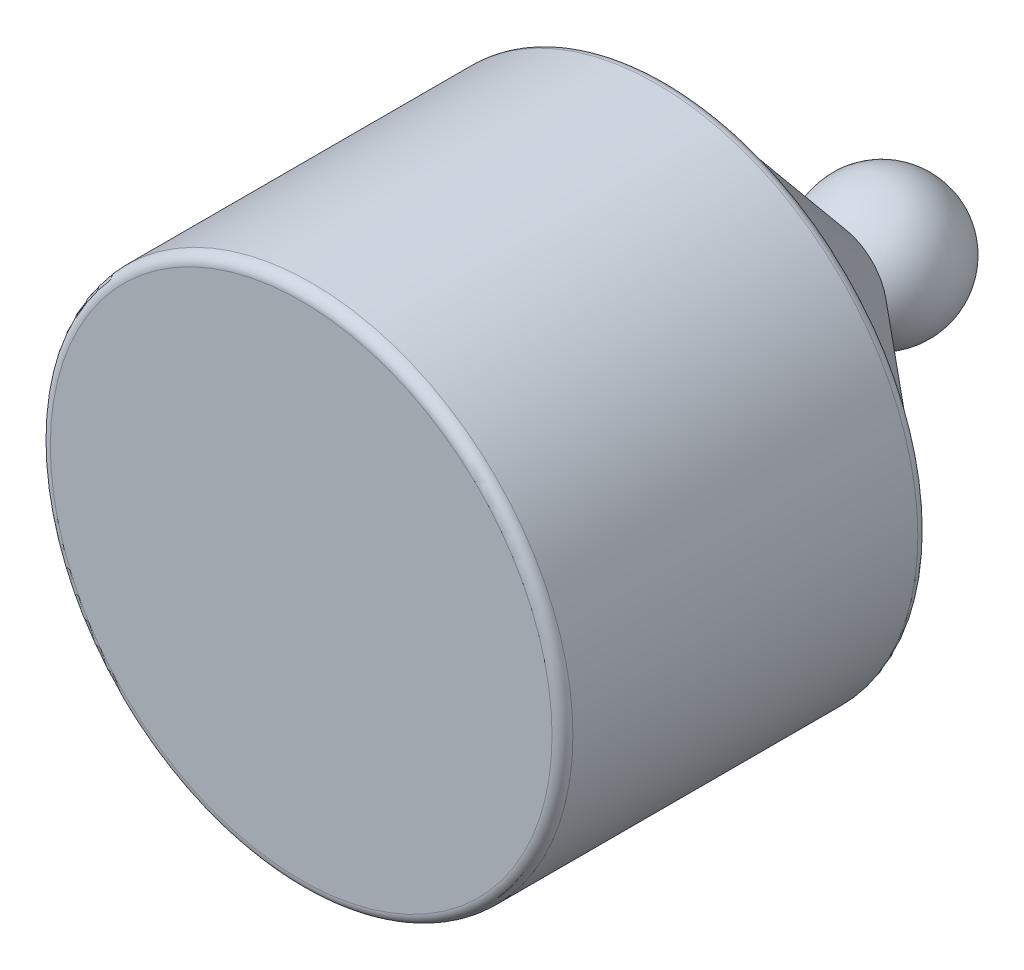
from build123d import *

# Parameters (mm, degrees)
SKETCH1_R           = 5
BOSS_EXTRUDE1_DEPTH = 7
FILLET2_R           = 0.2
FILLET3_R           = 0.2


with BuildPart() as part:
    # Sketch1 → Boss-Extrude1 (new body)
    with BuildSketch(Plane.XY):
        with Locations(Location((0, 0, 0), (0, 0, 180))):
            Circle(SKETCH1_R)
    extrude(amount=BOSS_EXTRUDE1_DEPTH)

    # Fillet2
    fillet2_edges = [part.edges().sort_by_distance(p)[0] for p in [
        (5, 0, 7),
    ]]
    fillet(fillet2_edges, radius=FILLET2_R)

    # Fillet3
    fillet3_edges = [part.edges().sort_by_distance(p)[0] for p in [
        (5, 0, 0),
    ]]
    fillet(fillet3_edges, radius=FILLET3_R)

    # Sketch4 → Revolve1 (revolve)
    with BuildSketch(Plane(origin=(0, 0, 0), x_dir=(1, 0, 0), z_dir=(0, 1, 0))):
        with BuildLine():
            Line((4.8, 0), (0.97819093, 3.230361511))
            ThreePointArc((0.97819093, 3.230361511), (1.18953252, 4.638794693), (0, 5.421968799))
            Line((0, 5.421968799), (0, 0))
            Line((0, 0), (4.8, 0))
        make_face()
    revolve(axis=Axis((0, 0, -5.421968799), (0, 0, 1)))


solid = part.part
